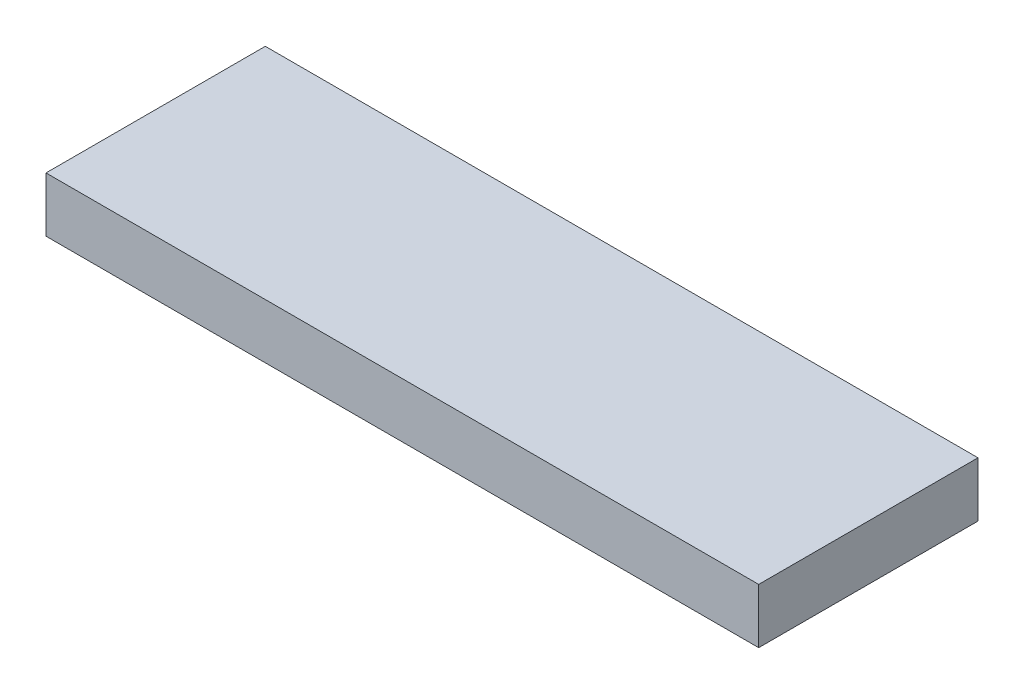
from build123d import *

# Parameters (mm, degrees)
SZKIC1_W                    = 13
SZKIC1_H                    = 4
DODANIE_WYCI_GNI_CIE2_DEPTH = 1


with BuildPart() as part:
    # Szkic1 → Dodanie-wyciągnięcie2 (new body)
    with BuildSketch(Plane(origin=(0, 0, 0), x_dir=(1, 0, 0), z_dir=(0, 1, 0))):
        Rectangle(SZKIC1_W, SZKIC1_H)
    extrude(amount=DODANIE_WYCI_GNI_CIE2_DEPTH)


solid = part.part
